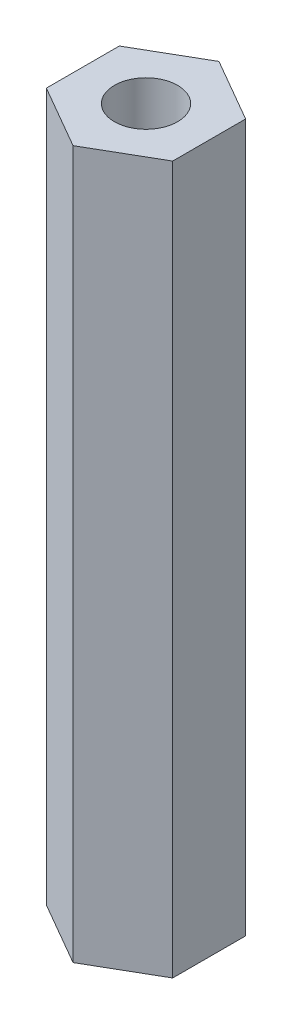
from build123d import *

# Parameters (mm, degrees)
BOSS_EXTRUDE1_DEPTH     = 71.12
CUT_EXTRUDE1_DEPTH      = 72.778410635
CUT_EXTRUDE1_DEPTH_BACK = 72.778410635
SKETCH2_R               = 3.175


with BuildPart() as part:
    # Sketch1 → Boss-Extrude1 (new body)
    with BuildSketch(Plane(origin=(0, 0, 0), x_dir=(1, 0, 0), z_dir=(0, 1, 0))):
        Polygon((0, -7.332348419), (6.35, -3.666174209), (6.35, 3.666174209), (0, 7.332348419), (-6.35, 3.666174209), (-6.35, -3.666174209), align=None)
    extrude(amount=BOSS_EXTRUDE1_DEPTH)

    # Sketch2 → Cut-Extrude1 (cut, two sides: drawn at the far end of the back side and taken through both)
    with BuildSketch(Plane(origin=(0, 71.12, 0), x_dir=(1, 0, 0), z_dir=(0, 1, 0)).offset(-CUT_EXTRUDE1_DEPTH_BACK)):
        with Locations(Location((0, 0, 0), (0, 0, 270))):
            Circle(SKETCH2_R)
    extrude(amount=CUT_EXTRUDE1_DEPTH + CUT_EXTRUDE1_DEPTH_BACK, mode=Mode.SUBTRACT)


solid = part.part
